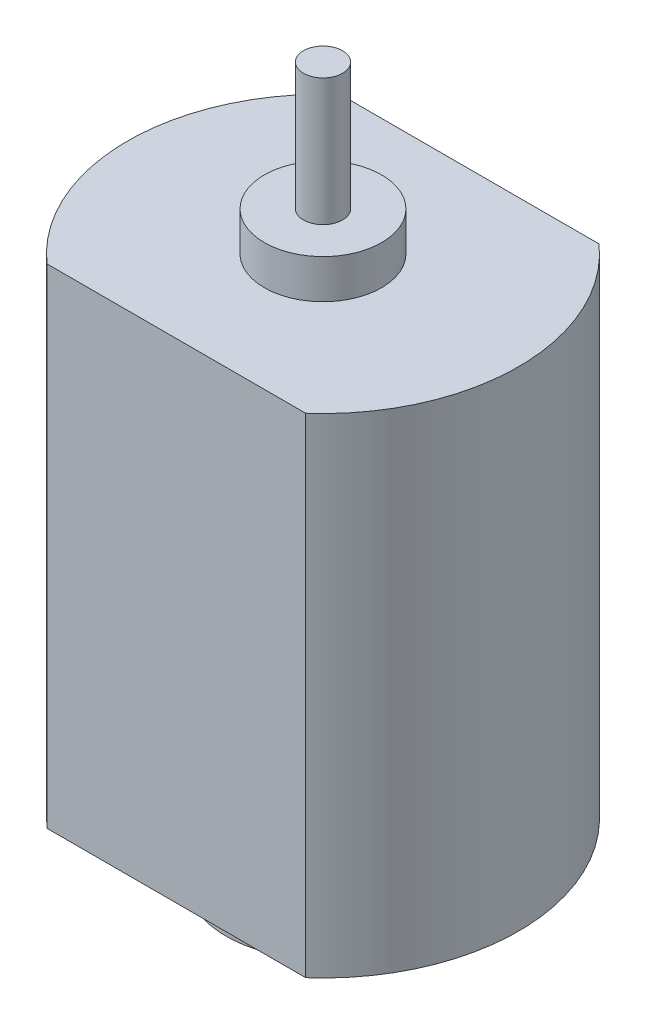
from build123d import *

# Parameters (mm, degrees)
BOSS_EXTRUDE1_DEPTH = 25
SKETCH1_3_R         = 3
BOSS_EXTRUDE2_DEPTH = 2
SKETCH1_4_R         = 1
BOSS_EXTRUDE3_DEPTH = 8.5
BOSS_EXTRUDE4_DEPTH = 2.75


with BuildPart() as part:
    # Sketch1 → Boss-Extrude1 (new body)
    with BuildSketch(Plane(origin=(0, 0, 0), x_dir=(1, 0, 0), z_dir=(0, 1, 0))):
        with BuildLine():
            ThreePointArc((-6.614378278, 7.5), (-10, 0), (-6.614378278, -7.5))
            Line((-6.614378278, -7.5), (6.614378278, -7.5))
            ThreePointArc((6.614378278, -7.5), (10, 0), (6.614378278, 7.5))
            Line((6.614378278, 7.5), (-6.614378278, 7.5))
        make_face()
    extrude(amount=-BOSS_EXTRUDE1_DEPTH)

    # Sketch1<3> → Boss-Extrude2 (add)
    with BuildSketch(Plane(origin=(0, 0, 0), x_dir=(1, 0, 0), z_dir=(0, 1, 0))):
        Circle(SKETCH1_3_R)
    extrude(amount=BOSS_EXTRUDE2_DEPTH)

    # Sketch1<4> → Boss-Extrude3 (add)
    with BuildSketch(Plane(origin=(0, 0, 0), x_dir=(1, 0, 0), z_dir=(0, 1, 0))):
        Circle(SKETCH1_4_R)
    extrude(amount=BOSS_EXTRUDE3_DEPTH)

    # Sketch2 → Boss-Extrude4 (add)
    with BuildSketch(Plane.XZ.offset(25)):
        with BuildLine():
            Line((-2.846049894, -4.05), (2.846049894, -4.05))
            ThreePointArc((2.846049894, -4.05), (0, 4.95), (-2.846049894, -4.05))
        make_face()
    extrude(amount=BOSS_EXTRUDE4_DEPTH)


solid = part.part
